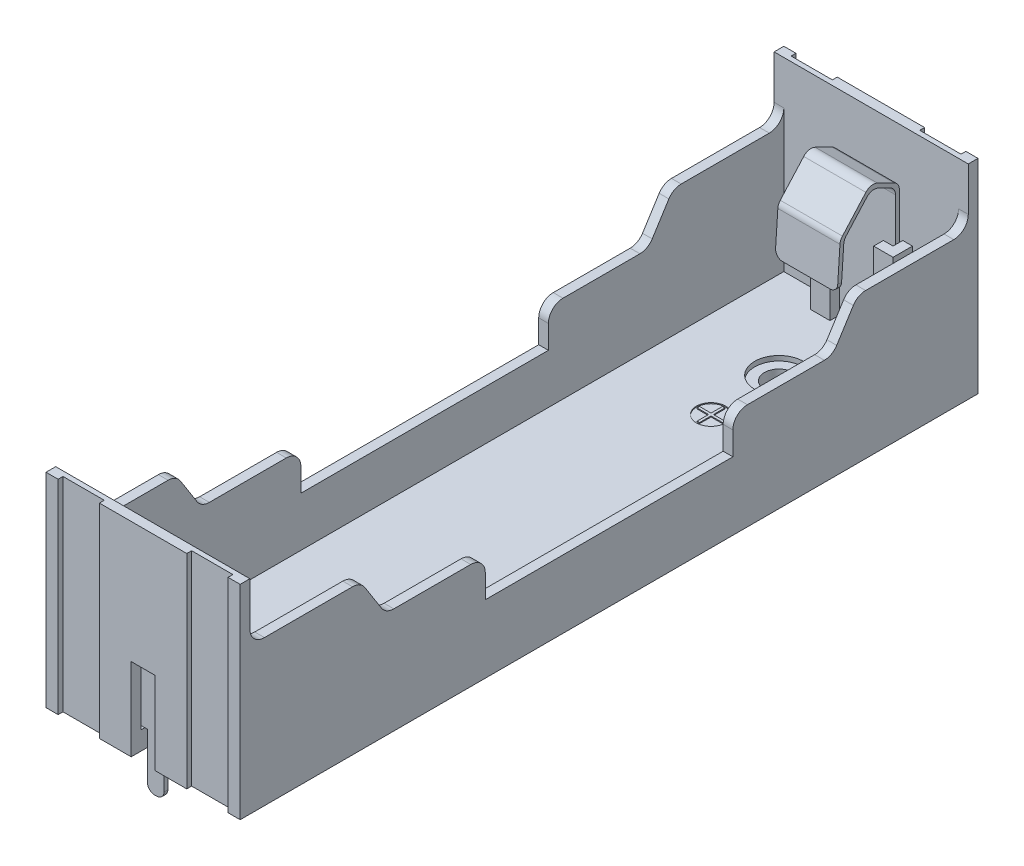
from build123d import *

# Parameters (mm, degrees)
SKETCH_1_W                  = 20
SKETCH_1_H                  = 76
EXTRUDE_739_DEPTH           = 21
CUT_EXTRUDE_1854_DEPTH      = 45.55333882
SKETCH_3_W                  = 18
SKETCH_3_H                  = 74
CUT_EXTRUDE_2415_DEPTH      = 19.1
CUT_EXTRUDE_2707_DEPTH      = 15
CUT_EXTRUDE_2707_DEPTH_BACK = 15
SKETCH_4_W                  = 74
SKETCH_4_H                  = 12
CUT_EXTRUDE_3306_DEPTH      = 15
FILLET_2_R                  = 1.5
FILLET_2_OF_MIRROR_2_R      = 1.5
SKETCH_6_W                  = 2.45
SKETCH_6_H                  = 7
CUT_EXTRUDE_4430_DEPTH      = 8.5
SKETCH_11_R                 = 1.5
CUT_EXTRUDE_4771_DEPTH      = 45.55333882
EXTRUDE_START               = -0.3
SKETCH_12_R                 = 2.8
SKETCH_12_R_2               = 1.5
EXTRUDE_5192_DEPTH          = 0.3
CUT_EXTRUDE_START           = -0.5
SKETCH_13_R                 = 2.5
SKETCH_13_R_2               = 1.5
CUT_EXTRUDE_17_DEPTH        = 0.5
SKETCH_14_R                 = 1.5
SKETCH_14_W                 = 0.25
SKETCH_14_H                 = 2.6
CUT_EXTRUDE_8091_DEPTH      = 0.1
EXTRUDE_9503_DEPTH          = 8.9
EXTRUDE_10350_DEPTH         = 3.2
SKETCH_17_W                 = 1.7
SKETCH_17_H                 = 0.4
EXTRUDE_10802_DEPTH         = 5.5
FILLET_3_R                  = 1
FILLET_4_R                  = 0.75


with BuildPart() as part:
    # Эскиз1 → Extrude 739 (new body)
    with BuildSketch(Plane(origin=(0, 0, 0), x_dir=(1, 0, 0), z_dir=(0, 1, 0))):
        Rectangle(SKETCH_1_W, SKETCH_1_H)
    extrude(amount=EXTRUDE_739_DEPTH)

    # Эскиз2 → Cut-Extrude 1854 (cut, through all)
    with BuildSketch(Plane(origin=(0, 0, 0), x_dir=(1, 0, 0), z_dir=(0, 1, 0))):
        Polygon((-4.5, 37.5), (-4.5, 38), (4.5, 38), (4.5, 37.5), (8.75, 37.5), (8.75, 38), (10, 38), (10, 46.507054696), (-10, 46.507054696), (-10, 38), (-8.75, 38), (-8.75, 37.5), align=None)
    cut_extrude_1854 = extrude(amount=CUT_EXTRUDE_1854_DEPTH, mode=Mode.SUBTRACT)

    # Зеркальное отражение1: Cut-Extrude 1854 across plane
    add(cut_extrude_1854.mirror(Plane.XY), mode=Mode.SUBTRACT)

    # Эскиз3 → Cut-Extrude 2415 (cut)
    with BuildSketch(Plane(origin=(0, 21, 0), x_dir=(1, 0, 0), z_dir=(0, 1, 0))):
        Rectangle(SKETCH_3_W, SKETCH_3_H)
    extrude(amount=-CUT_EXTRUDE_2415_DEPTH, mode=Mode.SUBTRACT)

    # Эскиз4 → Cut-Extrude 2707 (cut, two sides: drawn at the far end of the back side and taken through both)
    with BuildSketch(Plane(origin=(0, 0, 0), x_dir=(0, 0, -1), z_dir=(1, 0, 0)).offset(-CUT_EXTRUDE_2707_DEPTH_BACK)):
        with Locations((0, 21)):
            Rectangle(SKETCH_4_W, SKETCH_4_H)
    extrude(amount=CUT_EXTRUDE_2707_DEPTH + CUT_EXTRUDE_2707_DEPTH_BACK, mode=Mode.SUBTRACT)

    # Эскиз5 → Cut-Extrude 3306 (cut)
    with BuildSketch(Plane(origin=(10, 0, 0), x_dir=(0, 0, -1), z_dir=(1, 0, 0))):
        Polygon((35.6, 21), (-35.6, 21), (-35.6, 15), (-25.6, 15), (-23, 10.9), (-12.75, 10.9), (-12.75, 7), (12.75, 7), (12.75, 10.9), (23, 10.9), (25.6, 15), (35.6, 15), align=None)
    cut_extrude_3306 = extrude(amount=-CUT_EXTRUDE_3306_DEPTH, mode=Mode.SUBTRACT)

    # Скругление2
    fillet_2_edges = [part.edges().sort_by_distance(p)[0] for p in [
        (9.5, 10.9, -23),
        (9.5, 10.9, -12.75),
        (9.5, 10.9, 12.75),
        (9.5, 10.9, 23),
        (9.5, 15, -37),
        (9.5, 15, -25.6),
        (9.5, 15, 37),
        (9.5, 15, 25.6),
    ]]
    fillet(fillet_2_edges, radius=FILLET_2_R)

    # Зеркальное отражение2: Cut-Extrude 3306 across plane
    add(cut_extrude_3306.mirror(Plane(origin=(0, 0, 0), x_dir=(0, 0, 1), z_dir=(1, 0, 0))), mode=Mode.SUBTRACT)

    # Скругление2 of Зеркальное отражение2
    fillet_2_of_mirror_2_edges = [part.edges().sort_by_distance(p)[0] for p in [
        (-9.5, 10.9, -23),
        (-9.5, 10.9, -12.75),
        (-9.5, 10.9, 12.75),
        (-9.5, 10.9, 23),
        (-9.5, 15, -37),
        (-9.5, 15, -25.6),
        (-9.5, 15, 37),
        (-9.5, 15, 25.6),
    ]]
    fillet(fillet_2_of_mirror_2_edges, radius=FILLET_2_OF_MIRROR_2_R)

    # Эскиз6 → Cut-Extrude 4430 (cut)
    with BuildSketch(Plane(origin=(0, 0, 0), x_dir=(1, 0, 0), z_dir=(0, 1, 0))):
        with Locations((0, -38)):
            Rectangle(SKETCH_6_W, SKETCH_6_H)
        with Locations((0, 38)):
            Rectangle(SKETCH_6_W, SKETCH_6_H)
    extrude(amount=CUT_EXTRUDE_4430_DEPTH, mode=Mode.SUBTRACT)

    # Эскиз11 → Cut-Extrude 4771 (cut, through all)
    with BuildSketch(Plane(origin=(0, 0, 0), x_dir=(1, 0, 0), z_dir=(0, 1, 0))):
        with Locations((0, 27.5)):
            Circle(SKETCH_11_R)
        with Locations((0, -27.5)):
            Circle(SKETCH_11_R)
    extrude(amount=CUT_EXTRUDE_4771_DEPTH, mode=Mode.SUBTRACT)

    # Эскиз12 → Extrude 5192 (add)
    # profile 1 of 2: a face of its own
    with BuildSketch(Plane(origin=(0, 0, 0), x_dir=(1, 0, 0), z_dir=(0, 1, 0)).offset(EXTRUDE_START)):
        with Locations((0, 27.5)):
            Circle(SKETCH_12_R)
        with Locations((0, 27.5)):
            Circle(SKETCH_12_R_2, mode=Mode.SUBTRACT)
    # profile 2 of 2: a face of its own
    with BuildSketch(Plane(origin=(0, 0, 0), x_dir=(1, 0, 0), z_dir=(0, 1, 0)).offset(EXTRUDE_START)):
        with Locations((0, -27.5)):
            Circle(SKETCH_12_R)
        with Locations((0, -27.5)):
            Circle(SKETCH_12_R_2, mode=Mode.SUBTRACT)
    extrude(amount=EXTRUDE_5192_DEPTH)

    # Эскиз13 → Вырез-Вытянуть17 (cut)
    # profile 1 of 2: a face of its own
    with BuildSketch(Plane(origin=(0, 1.9, 0), x_dir=(1, 0, 0), z_dir=(0, 1, 0)).offset(CUT_EXTRUDE_START)):
        with Locations((0, -27.5)):
            Circle(SKETCH_13_R)
        with Locations((0, -27.5)):
            Circle(SKETCH_13_R_2, mode=Mode.SUBTRACT)
    # profile 2 of 2: a face of its own
    with BuildSketch(Plane(origin=(0, 1.9, 0), x_dir=(1, 0, 0), z_dir=(0, 1, 0)).offset(CUT_EXTRUDE_START)):
        with Locations((0, 27.5)):
            Circle(SKETCH_13_R)
        with Locations((0, 27.5)):
            Circle(SKETCH_13_R_2, mode=Mode.SUBTRACT)
    extrude(amount=CUT_EXTRUDE_17_DEPTH, mode=Mode.SUBTRACT)

    # Эскиз14 → Cut-Extrude 8091 (cut)
    # profile 1 of 2: a face of its own
    with BuildSketch(Plane(origin=(0, 1.9, 0), x_dir=(1, 0, 0), z_dir=(0, 1, 0))):
        with Locations((0, 20.5)):
            Circle(SKETCH_14_R)
        Polygon((-0.125, 21.8), (0.125, 21.8), (0.125, 20.625), (1.3, 20.625), (1.3, 20.375), (0.125, 20.375), (0.125, 19.2), (-0.125, 19.2), (-0.125, 20.375), (-1.3, 20.375), (-1.3, 20.625), (-0.125, 20.625), align=None, mode=Mode.SUBTRACT)
    # profile 2 of 2: a face of its own
    with BuildSketch(Plane(origin=(0, 1.9, 0), x_dir=(1, 0, 0), z_dir=(0, 1, 0))):
        with Locations((0, -20.5)):
            Circle(SKETCH_14_R)
        with Locations((0, -20.5)):
            Rectangle(SKETCH_14_W, SKETCH_14_H, mode=Mode.SUBTRACT)
    extrude(amount=-CUT_EXTRUDE_8091_DEPTH, mode=Mode.SUBTRACT)

    # Эскиз15 → Extrude 9503 (add)
    with BuildSketch(Plane(origin=(0, 1.9, 0), x_dir=(1, 0, 0), z_dir=(0, 1, 0))):
        Polygon((-2.25, 35), (-4.25, 35), (-4.25, 37), (-3.25, 37), (-3.25, 36), (-2.25, 36), align=None)
        Polygon((2.25, 35), (2.25, 36), (3.25, 36), (3.25, 37), (4.25, 37), (4.25, 35), align=None)
        Polygon((4.25, -35), (2.25, -35), (2.25, -36), (3.25, -36), (3.25, -37), (4.25, -37), align=None)
        Polygon((-2.25, -36), (-2.25, -35), (-4.25, -35), (-4.25, -37), (-3.25, -37), (-3.25, -36), align=None)
    extrude(amount=EXTRUDE_9503_DEPTH)


with BuildPart() as body_2:
    # Эскиз16 → Extrude 10350 (new, symmetric)
    with BuildSketch(Plane.ZY):
        Polygon((-36.3, 2), (-36.3, 15.826972516), (-33.848539634, 17.01426896), (-30.994965619, 13.823876222), (-30.699555061, 9.402575836), (-30.300444939, 9.429242503), (-30.605034381, 13.987919845), (-33.751460366, 17.50573104), (-36.7, 16.077688118), (-36.7, 2), align=None)
    extrude(amount=EXTRUDE_10350_DEPTH, both=True)

    # Эскиз17 → Extrude 10802 (add)
    with BuildSketch(Plane.XZ.offset(-2)):
        with Locations((0, -36.5)):
            Rectangle(SKETCH_17_W, SKETCH_17_H)
    extrude(amount=EXTRUDE_10802_DEPTH)

    # Скругление3
    fillet_3_edges = [body_2.edges().sort_by_distance(p)[0] for p in [
        (0, 13.823876222, -30.994965619),
        (0, 13.987919845, -30.605034381),
        (0, 17.01426896, -33.848539634),
        (0, 17.50573104, -33.751460366),
        (0, 15.826972516, -36.3),
        (0, 16.077688118, -36.7),
    ]]
    fillet(fillet_3_edges, radius=FILLET_3_R)

    # Скругление4
    fillet_4_edges = [body_2.edges().sort_by_distance(p)[0] for p in [
        (3.2, 2, -36.5),
        (0.85, -3.5, -36.5),
        (-0.85, -3.5, -36.5),
        (-3.2, 2, -36.5),
        (3.2, 9.41590917, -30.5),
        (-3.2, 9.41590917, -30.5),
    ]]
    fillet(fillet_4_edges, radius=FILLET_4_R)


with BuildPart() as body_3:
    # Mirror1: mirrored copy
    add(body_2.part.mirror(Plane.XY))


solid = Compound([part.part, body_2.part, body_3.part])
